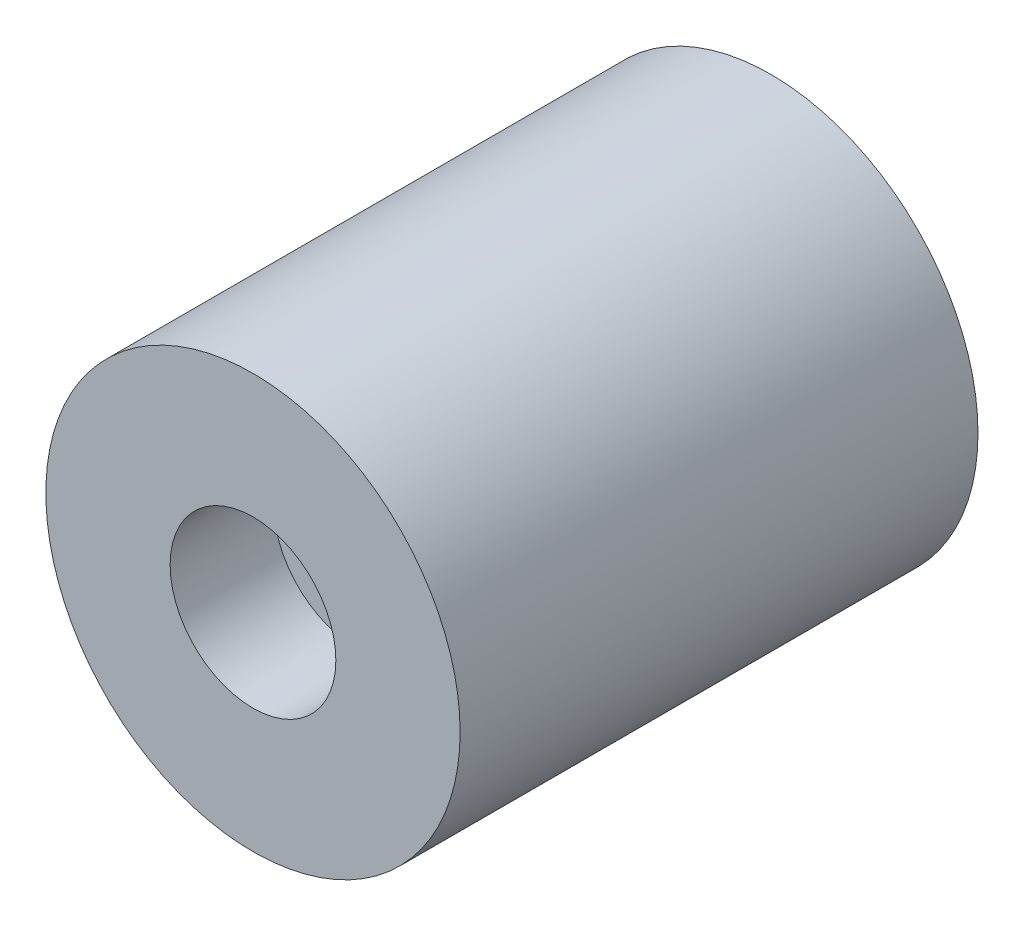
from build123d import *

# Parameters (mm, degrees)
BOSS_EXTRUDE1_DEPTH      = 7.5
BOSS_EXTRUDE1_DEPTH_BACK = 7.5
SKETCH1_R                = 10
BOSS_EXTRUDE2_DEPTH      = 12.5
BOSS_EXTRUDE2_DEPTH_BACK = 12.5
SKETCH1_2_R              = 10
SKETCH1_2_R_2            = 4


with BuildPart() as part:
    # Sketch1 → Boss-Extrude1 (new, two sides: drawn at the far end of the back side and taken through both)
    with BuildSketch(Plane.XY.offset(-BOSS_EXTRUDE1_DEPTH_BACK)):
        Circle(SKETCH1_R)
    extrude(amount=BOSS_EXTRUDE1_DEPTH + BOSS_EXTRUDE1_DEPTH_BACK)

    # Sketch1<2> → Boss-Extrude2 (add, two sides: drawn at the far end of the back side and taken through both)
    with BuildSketch(Plane.XY.offset(-BOSS_EXTRUDE2_DEPTH_BACK)):
        Circle(SKETCH1_2_R)
        Circle(SKETCH1_2_R_2, mode=Mode.SUBTRACT)
    extrude(amount=BOSS_EXTRUDE2_DEPTH + BOSS_EXTRUDE2_DEPTH_BACK)


solid = part.part
